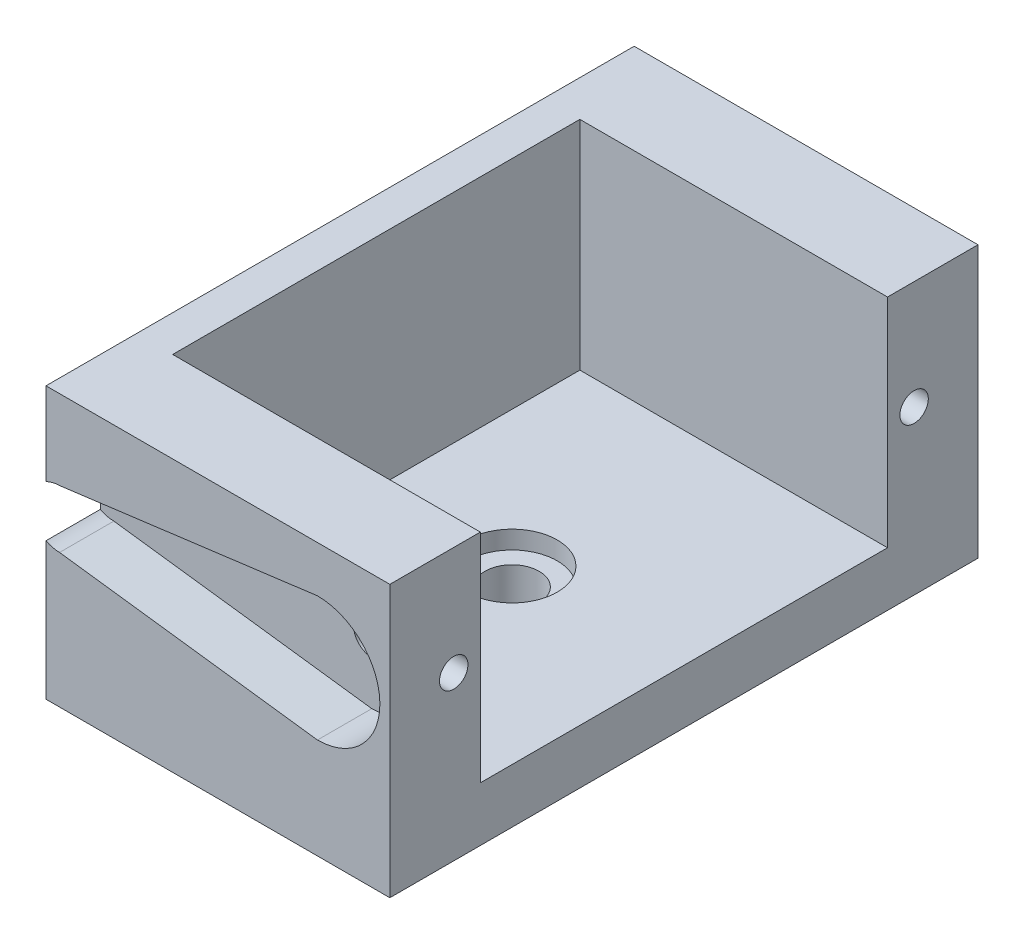
from build123d import *

# Parameters (mm, degrees)
SKETCH_1_W           = 5
SKETCH_1_H           = 12
EXTRUDE_1_DEPTH      = 19
EXTRUDE_1_2_DEPTH    = 19
SKETCH_2_W           = 32.5
SKETCH_2_H           = 12
EXTRUDE_2_DEPTH      = 2
SKETCH_3_R           = 0.785
CUT_EXTRUDE_2_DEPTH  = 3
CUT_EXTRUDE_3_DEPTH  = 3
EXTRUDE_START        = 1
SKETCH_7_R           = 0.785
EXTRUDE_3_DEPTH      = 1
SKETCH_8_W           = 4.508312044
SKETCH_8_H           = 2.561477722
SKETCH_8_R           = 1
CUT_EXTRUDE_9_DEPTH  = 1
SKETCH_9_R           = 1
CUT_EXTRUDE_10_DEPTH = 3
SKETCH_12_R          = 1.5
CUT_EXTRUDE_11_DEPTH = 0.5
SKETCH_13_W          = 19
SKETCH_13_H          = 32.5
EXTRUDE_4_DEPTH      = 3
SKETCH_14_R          = 1.5
CUT_EXTRUDE_12_DEPTH = 3
SKETCH_15_R          = 2.5
CUT_EXTRUDE_13_DEPTH = 1


with BuildPart() as part:
    # 草图1 → 凸台-拉伸1 (new body)
    with BuildSketch(Plane(origin=(0, 0, 0), x_dir=(0, 0, -1), z_dir=(1, 0, 0))):
        with Locations((-13.75, 0)):
            Rectangle(SKETCH_1_W, SKETCH_1_H)
    extrude(amount=EXTRUDE_1_DEPTH)



with BuildPart() as body_2:
    # 草图1 → Extrude 1 2 (new body)
    with BuildSketch(Plane(origin=(0, 0, 0), x_dir=(0, 0, -1), z_dir=(1, 0, 0))):
        with Locations((13.75, 0)):
            Rectangle(SKETCH_1_W, SKETCH_1_H)
    extrude(amount=EXTRUDE_1_2_DEPTH)


with BuildPart() as part_1:
    add(part.part)

    add(body_2.part)  # 凸台-拉伸2 merges body 2
    # 草图2 → 凸台-拉伸2 (add)
    with BuildSketch(Plane.ZY):
        Rectangle(SKETCH_2_W, SKETCH_2_H)
    extrude(amount=-EXTRUDE_2_DEPTH)

    # 草图3 → 切除-拉伸2 (cut)
    with BuildSketch(Plane(origin=(19, 0, 0), x_dir=(0, 0, -1), z_dir=(1, 0, 0))):
        with Locations((-12.72, 0)):
            Circle(SKETCH_3_R)
        with Locations((12.72, 0)):
            Circle(SKETCH_3_R)
    extrude(amount=-CUT_EXTRUDE_2_DEPTH, mode=Mode.SUBTRACT)

    # 草图4 → 切除-拉伸3 (cut)
    with BuildSketch(Plane.XY.offset(16.25)):
        with BuildLine():
            ThreePointArc((0.75, 1.6), (-0.85, 0), (0.75, -1.6))
            Line((0.75, -1.6), (15, -3.45))
            ThreePointArc((15, -3.45), (18.45, 0), (15, 3.45))
            Line((15, 3.45), (0.75, 1.6))
        make_face()
    extrude(amount=-CUT_EXTRUDE_3_DEPTH, mode=Mode.SUBTRACT)

    # 草图7 → 凸台-拉伸3 (add)
    with BuildSketch(Plane(origin=(16, 0, 0), x_dir=(0, 0, -1), z_dir=(1, 0, 0)).offset(EXTRUDE_START)):
        with Locations((-12.72, 0)):
            Circle(SKETCH_7_R)
    extrude(amount=-EXTRUDE_3_DEPTH)

    # 草图8 → 切除-拉伸9 (cut)
    with BuildSketch(Plane.XY.offset(13.25)):
        with Locations((15, 0)):
            Rectangle(SKETCH_8_W, SKETCH_8_H)
        with Locations((15, 0)):
            Circle(SKETCH_8_R, mode=Mode.SUBTRACT)
    extrude(amount=CUT_EXTRUDE_9_DEPTH, mode=Mode.SUBTRACT)

    # 草图9 → 切除-拉伸10 (cut)
    with BuildSketch(Plane.XY.offset(13.25)):
        with Locations((15, 0)):
            Circle(SKETCH_9_R)
    extrude(amount=-CUT_EXTRUDE_10_DEPTH, mode=Mode.SUBTRACT)

    # 草图12 → 切除-拉伸11 (cut)
    with BuildSketch(Plane(origin=(0, 0, 11.25), x_dir=(-1, 0, 0), z_dir=(0, 0, -1))):
        with Locations((-15, 0)):
            Circle(SKETCH_12_R)
    extrude(amount=-CUT_EXTRUDE_11_DEPTH, mode=Mode.SUBTRACT)

    # 草图13 → 凸台-拉伸4 (add)
    with BuildSketch(Plane.XZ.offset(6)):
        with Locations((9.5, 0)):
            Rectangle(SKETCH_13_W, SKETCH_13_H)
    extrude(amount=EXTRUDE_4_DEPTH)

    # 草图14 → 切除-拉伸12 (cut)
    with BuildSketch(Plane.XZ.offset(9)):
        with Locations(Location((9.5, 0, 0), (0, 0, 270))):
            Circle(SKETCH_14_R)
    extrude(amount=-CUT_EXTRUDE_12_DEPTH, mode=Mode.SUBTRACT)

    # 草图15 → 切除-拉伸13 (cut)
    with BuildSketch(Plane(origin=(0, -6, 0), x_dir=(1, 0, 0), z_dir=(0, 1, 0))):
        with Locations(Location((9.5, 0, 0), (0, 0, 270))):
            Circle(SKETCH_15_R)
    extrude(amount=-CUT_EXTRUDE_13_DEPTH, mode=Mode.SUBTRACT)


solid = part_1.part
